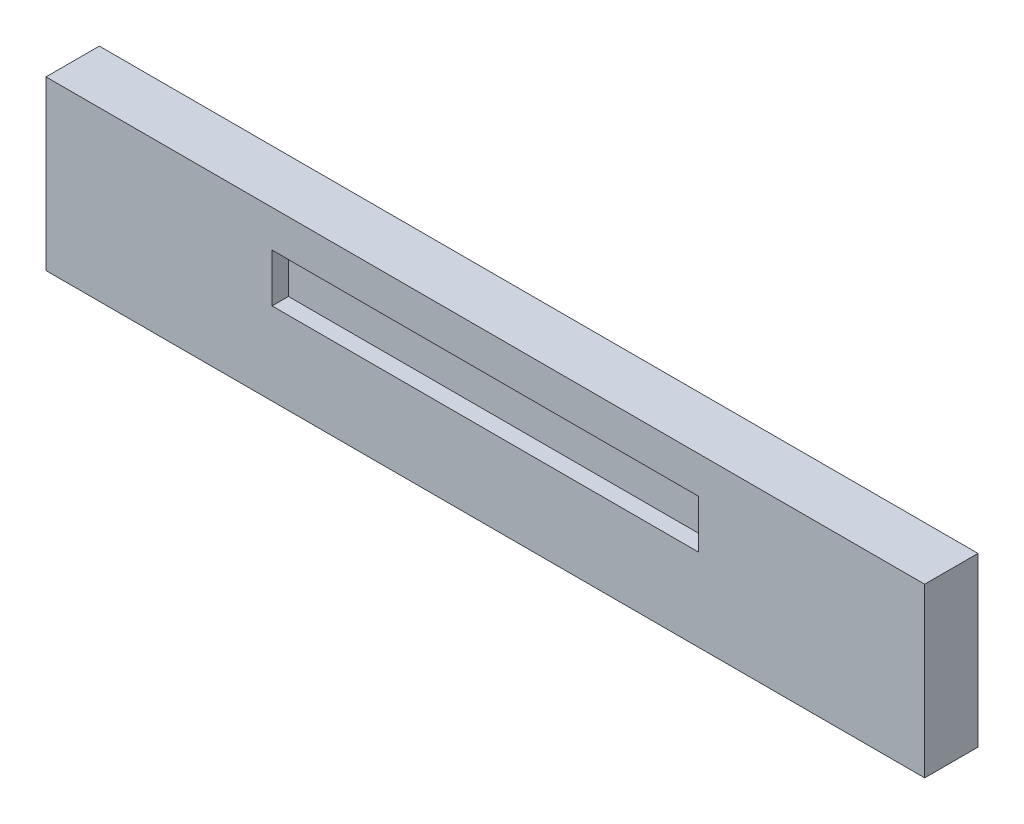
from build123d import *

# Parameters (mm, degrees)
CEK_ICECEK_ON_PU_37_5_1_START = 1
SKETCH1_W                     = 618
SKETCH1_H                     = 118
CEK_ICECEK_ON_PU_37_5_1_DEPTH = 37.5
CEK_ICECEK_ON_PU_37_5_2_START = 27
SKETCH2_W                     = 300
SKETCH2_H                     = 34
CEK_ICECEK_ON_PU_37_5_2_DEPTH = 14


with BuildPart() as part:
    # Sketch1 → CEK_icecek_on_pu_37.5_1 (new body)
    with BuildSketch(Plane.XY.offset(CEK_ICECEK_ON_PU_37_5_1_START)):
        with Locations((309, 59)):
            Rectangle(SKETCH1_W, SKETCH1_H)
    extrude(amount=CEK_ICECEK_ON_PU_37_5_1_DEPTH)

    # Sketch2 → CEK_icecek_on_pu_37.5_2 (cut)
    with BuildSketch(Plane.XY.offset(CEK_ICECEK_ON_PU_37_5_2_START)):
        with Locations((309, 75)):
            Rectangle(SKETCH2_W, SKETCH2_H)
    extrude(amount=CEK_ICECEK_ON_PU_37_5_2_DEPTH, mode=Mode.SUBTRACT)


solid = part.part
